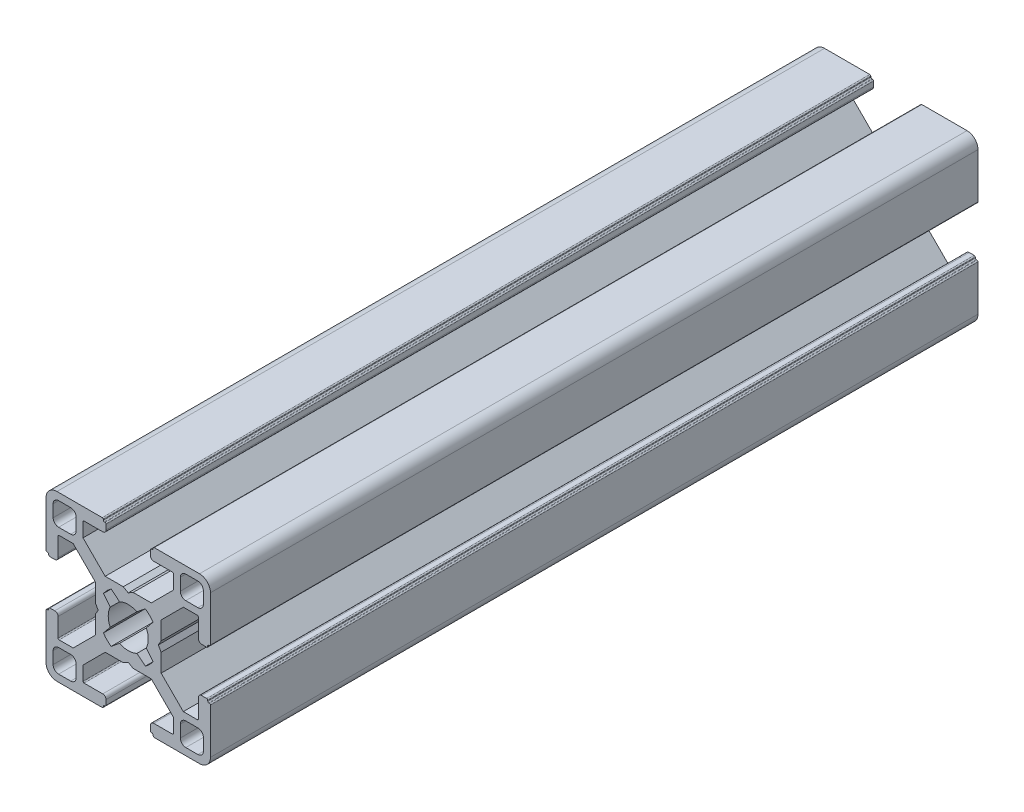
from build123d import *

# Parameters (mm, degrees)
DODANIE_WYCI_GNI_CIE1_DEPTH = 70


with BuildPart() as part:
    # Szkic1 → Dodanie-wyciągnięcie1 (new, symmetric)
    with BuildSketch(Plane.XY):
        with BuildLine():
            Line((0, -5.48), (0.90066642, -6))
            Line((0.90066642, -6), (4.203948776, -6))
            Line((4.203948776, -6), (8.25, -10.046051224))
            Line((8.25, -10.046051224), (8.25, -12.6))
            ThreePointArc((8.25, -12.6), (8.191421356, -12.741421356), (8.05, -12.8))
            Line((8.05, -12.8), (4.65, -12.8))
            ThreePointArc((4.65, -12.8), (4.225735931, -12.975735931), (4.05, -13.4))
            Line((4.05, -13.4), (4.05, -14.3))
            ThreePointArc((4.05, -14.3), (4.108578644, -14.441421356), (4.25, -14.5))
            Line((4.25, -14.5), (4.35, -14.5))
            ThreePointArc((4.35, -14.5), (4.491421356, -14.558578644), (4.55, -14.7))
            Line((4.55, -14.7), (4.55, -14.8))
            ThreePointArc((4.55, -14.8), (4.608578644, -14.941421356), (4.75, -15))
            Line((4.75, -15), (13, -15))
            ThreePointArc((13, -15), (14.414213562, -14.414213562), (15, -13))
            Line((15, -13), (15, -4.75))
            ThreePointArc((15, -4.75), (14.941421356, -4.608578644), (14.8, -4.55))
            Line((14.8, -4.55), (14.7, -4.55))
            ThreePointArc((14.7, -4.55), (14.558578644, -4.491421356), (14.5, -4.35))
            Line((14.5, -4.35), (14.5, -4.25))
            ThreePointArc((14.5, -4.25), (14.441421356, -4.108578644), (14.3, -4.05))
            Line((14.3, -4.05), (13.4, -4.05))
            ThreePointArc((13.4, -4.05), (12.975735931, -4.225735931), (12.8, -4.65))
            Line((12.8, -4.65), (12.8, -8.05))
            ThreePointArc((12.8, -8.05), (12.741421356, -8.191421356), (12.6, -8.25))
            Line((12.6, -8.25), (10.046051224, -8.25))
            Line((10.046051224, -8.25), (6, -4.203948776))
            Line((6, -4.203948776), (6, -0.90066642))
            Line((6, -0.90066642), (5.48, 0))
            Line((5.48, 0), (6, 0.90066642))
            Line((6, 0.90066642), (6, 4.203948776))
            Line((6, 4.203948776), (10.046051224, 8.25))
            Line((10.046051224, 8.25), (12.6, 8.25))
            ThreePointArc((12.6, 8.25), (12.741421356, 8.191421356), (12.8, 8.05))
            Line((12.8, 8.05), (12.8, 4.65))
            ThreePointArc((12.8, 4.65), (12.975735931, 4.225735931), (13.4, 4.05))
            Line((13.4, 4.05), (14.3, 4.05))
            ThreePointArc((14.3, 4.05), (14.441421356, 4.108578644), (14.5, 4.25))
            Line((14.5, 4.25), (14.5, 4.35))
            ThreePointArc((14.5, 4.35), (14.558578644, 4.491421356), (14.7, 4.55))
            Line((14.7, 4.55), (14.8, 4.55))
            ThreePointArc((14.8, 4.55), (14.941421356, 4.608578644), (15, 4.75))
            Line((15, 4.75), (15, 13))
            ThreePointArc((15, 13), (14.414213562, 14.414213562), (13, 15))
            Line((13, 15), (4.75, 15))
            ThreePointArc((4.75, 15), (4.608578644, 14.941421356), (4.55, 14.8))
            Line((4.55, 14.8), (4.55, 14.7))
            ThreePointArc((4.55, 14.7), (4.491421356, 14.558578644), (4.35, 14.5))
            Line((4.35, 14.5), (4.25, 14.5))
            ThreePointArc((4.25, 14.5), (4.108578644, 14.441421356), (4.05, 14.3))
            Line((4.05, 14.3), (4.05, 13.4))
            ThreePointArc((4.05, 13.4), (4.225735931, 12.975735931), (4.65, 12.8))
            Line((4.65, 12.8), (8.05, 12.8))
            ThreePointArc((8.05, 12.8), (8.191421356, 12.741421356), (8.25, 12.6))
            Line((8.25, 12.6), (8.25, 10.046051224))
            Line((8.25, 10.046051224), (4.203948776, 6))
            Line((4.203948776, 6), (0.90066642, 6))
            Line((0.90066642, 6), (0, 5.48))
            Line((0, 5.48), (-0.90066642, 6))
            Line((-0.90066642, 6), (-4.203948776, 6))
            Line((-4.203948776, 6), (-8.25, 10.046051224))
            Line((-8.25, 10.046051224), (-8.25, 12.6))
            ThreePointArc((-8.25, 12.6), (-8.191421356, 12.741421356), (-8.05, 12.8))
            Line((-8.05, 12.8), (-4.65, 12.8))
            ThreePointArc((-4.65, 12.8), (-4.225735931, 12.975735931), (-4.05, 13.4))
            Line((-4.05, 13.4), (-4.05, 14.3))
            ThreePointArc((-4.05, 14.3), (-4.108578644, 14.441421356), (-4.25, 14.5))
            Line((-4.25, 14.5), (-4.35, 14.5))
            ThreePointArc((-4.35, 14.5), (-4.491421356, 14.558578644), (-4.55, 14.7))
            Line((-4.55, 14.7), (-4.55, 14.8))
            ThreePointArc((-4.55, 14.8), (-4.608578644, 14.941421356), (-4.75, 15))
            Line((-4.75, 15), (-13, 15))
            ThreePointArc((-13, 15), (-14.414213562, 14.414213562), (-15, 13))
            Line((-15, 13), (-15, 4.75))
            ThreePointArc((-15, 4.75), (-14.941421356, 4.608578644), (-14.8, 4.55))
            Line((-14.8, 4.55), (-14.7, 4.55))
            ThreePointArc((-14.7, 4.55), (-14.558578644, 4.491421356), (-14.5, 4.35))
            Line((-14.5, 4.35), (-14.5, 4.25))
            ThreePointArc((-14.5, 4.25), (-14.441421356, 4.108578644), (-14.3, 4.05))
            Line((-14.3, 4.05), (-13.4, 4.05))
            ThreePointArc((-13.4, 4.05), (-12.975735931, 4.225735931), (-12.8, 4.65))
            Line((-12.8, 4.65), (-12.8, 8.05))
            ThreePointArc((-12.8, 8.05), (-12.741421356, 8.191421356), (-12.6, 8.25))
            Line((-12.6, 8.25), (-10.046051224, 8.25))
            Line((-10.046051224, 8.25), (-6, 4.203948776))
            Line((-6, 4.203948776), (-6, 0.90066642))
            Line((-6, 0.90066642), (-5.48, 0))
            Line((-5.48, 0), (-6, -0.90066642))
            Line((-6, -0.90066642), (-6, -4.203948776))
            Line((-6, -4.203948776), (-10.046051224, -8.25))
            Line((-10.046051224, -8.25), (-12.6, -8.25))
            ThreePointArc((-12.6, -8.25), (-12.741421356, -8.191421356), (-12.8, -8.05))
            Line((-12.8, -8.05), (-12.8, -4.65))
            ThreePointArc((-12.8, -4.65), (-12.975735931, -4.225735931), (-13.4, -4.05))
            Line((-13.4, -4.05), (-14.3, -4.05))
            ThreePointArc((-14.3, -4.05), (-14.441421356, -4.108578644), (-14.5, -4.25))
            Line((-14.5, -4.25), (-14.5, -4.35))
            ThreePointArc((-14.5, -4.35), (-14.558578644, -4.491421356), (-14.7, -4.55))
            Line((-14.7, -4.55), (-14.8, -4.55))
            ThreePointArc((-14.8, -4.55), (-14.941421356, -4.608578644), (-15, -4.75))
            Line((-15, -4.75), (-15, -13))
            ThreePointArc((-15, -13), (-14.414213562, -14.414213562), (-13, -15))
            Line((-13, -15), (-4.75, -15))
            ThreePointArc((-4.75, -15), (-4.608578644, -14.941421356), (-4.55, -14.8))
            Line((-4.55, -14.8), (-4.55, -14.7))
            ThreePointArc((-4.55, -14.7), (-4.491421356, -14.558578644), (-4.35, -14.5))
            Line((-4.35, -14.5), (-4.25, -14.5))
            ThreePointArc((-4.25, -14.5), (-4.108578644, -14.441421356), (-4.05, -14.3))
            Line((-4.05, -14.3), (-4.05, -13.4))
            ThreePointArc((-4.05, -13.4), (-4.225735931, -12.975735931), (-4.65, -12.8))
            Line((-4.65, -12.8), (-8.05, -12.8))
            ThreePointArc((-8.05, -12.8), (-8.191421356, -12.741421356), (-8.25, -12.6))
            Line((-8.25, -12.6), (-8.25, -10.046051224))
            Line((-8.25, -10.046051224), (-4.203948776, -6))
            Line((-4.203948776, -6), (-0.90066642, -6))
            Line((-0.90066642, -6), (0, -5.48))
        make_face()
        with BuildLine():
            Line((12.7, 13.7), (10.5, 13.7))
            ThreePointArc((10.5, 13.7), (9.792893219, 13.407106781), (9.5, 12.7))
            Line((9.5, 12.7), (9.5, 10.5))
            ThreePointArc((9.5, 10.5), (9.792893219, 9.792893219), (10.5, 9.5))
            Line((10.5, 9.5), (12.7, 9.5))
            ThreePointArc((12.7, 9.5), (13.407106781, 9.792893219), (13.7, 10.5))
            Line((13.7, 10.5), (13.7, 12.7))
            ThreePointArc((13.7, 12.7), (13.407106781, 13.407106781), (12.7, 13.7))
        make_face(mode=Mode.SUBTRACT)
        with BuildLine():
            Line((-1.58286583, 3.288926233), (-3.117157854, 4.531371416))
            ThreePointArc((-3.117157854, 4.531371416), (-3.889087297, 3.889087297), (-4.531371416, 3.117157854))
            Line((-4.531371416, 3.117157854), (-3.288926233, 1.58286583))
            ThreePointArc((-3.288926233, 1.58286583), (-3.65, 0), (-3.288926233, -1.58286583))
            Line((-3.288926233, -1.58286583), (-4.531371416, -3.117157854))
            ThreePointArc((-4.531371416, -3.117157854), (-3.889087297, -3.889087297), (-3.117157854, -4.531371416))
            Line((-3.117157854, -4.531371416), (-1.58286583, -3.288926233))
            ThreePointArc((-1.58286583, -3.288926233), (0, -3.65), (1.58286583, -3.288926233))
            Line((1.58286583, -3.288926233), (3.117157854, -4.531371416))
            ThreePointArc((3.117157854, -4.531371416), (3.889087297, -3.889087297), (4.531371416, -3.117157854))
            Line((4.531371416, -3.117157854), (3.288926233, -1.58286583))
            ThreePointArc((3.288926233, -1.58286583), (3.65, 0), (3.288926233, 1.58286583))
            Line((3.288926233, 1.58286583), (4.531371416, 3.117157854))
            ThreePointArc((4.531371416, 3.117157854), (3.889087297, 3.889087297), (3.117157854, 4.531371416))
            Line((3.117157854, 4.531371416), (1.58286583, 3.288926233))
            ThreePointArc((1.58286583, 3.288926233), (0, 3.65), (-1.58286583, 3.288926233))
        make_face(mode=Mode.SUBTRACT)
        with BuildLine():
            Line((-12.7, -13.7), (-10.5, -13.7))
            ThreePointArc((-10.5, -13.7), (-9.792893219, -13.407106781), (-9.5, -12.7))
            Line((-9.5, -12.7), (-9.5, -10.5))
            ThreePointArc((-9.5, -10.5), (-9.792893219, -9.792893219), (-10.5, -9.5))
            Line((-10.5, -9.5), (-12.7, -9.5))
            ThreePointArc((-12.7, -9.5), (-13.407106781, -9.792893219), (-13.7, -10.5))
            Line((-13.7, -10.5), (-13.7, -12.7))
            ThreePointArc((-13.7, -12.7), (-13.407106781, -13.407106781), (-12.7, -13.7))
        make_face(mode=Mode.SUBTRACT)
        with BuildLine():
            Line((13.7, -12.7), (13.7, -10.5))
            ThreePointArc((13.7, -10.5), (13.407106781, -9.792893219), (12.7, -9.5))
            Line((12.7, -9.5), (10.5, -9.5))
            ThreePointArc((10.5, -9.5), (9.792893219, -9.792893219), (9.5, -10.5))
            Line((9.5, -10.5), (9.5, -12.7))
            ThreePointArc((9.5, -12.7), (9.792893219, -13.407106781), (10.5, -13.7))
            Line((10.5, -13.7), (12.7, -13.7))
            ThreePointArc((12.7, -13.7), (13.407106781, -13.407106781), (13.7, -12.7))
        make_face(mode=Mode.SUBTRACT)
        with BuildLine():
            Line((-10.5, 13.7), (-12.7, 13.7))
            ThreePointArc((-12.7, 13.7), (-13.407106781, 13.407106781), (-13.7, 12.7))
            Line((-13.7, 12.7), (-13.7, 10.5))
            ThreePointArc((-13.7, 10.5), (-13.407106781, 9.792893219), (-12.7, 9.5))
            Line((-12.7, 9.5), (-10.5, 9.5))
            ThreePointArc((-10.5, 9.5), (-9.792893219, 9.792893219), (-9.5, 10.5))
            Line((-9.5, 10.5), (-9.5, 12.7))
            ThreePointArc((-9.5, 12.7), (-9.792893219, 13.407106781), (-10.5, 13.7))
        make_face(mode=Mode.SUBTRACT)
    extrude(amount=DODANIE_WYCI_GNI_CIE1_DEPTH, both=True)


solid = part.part
